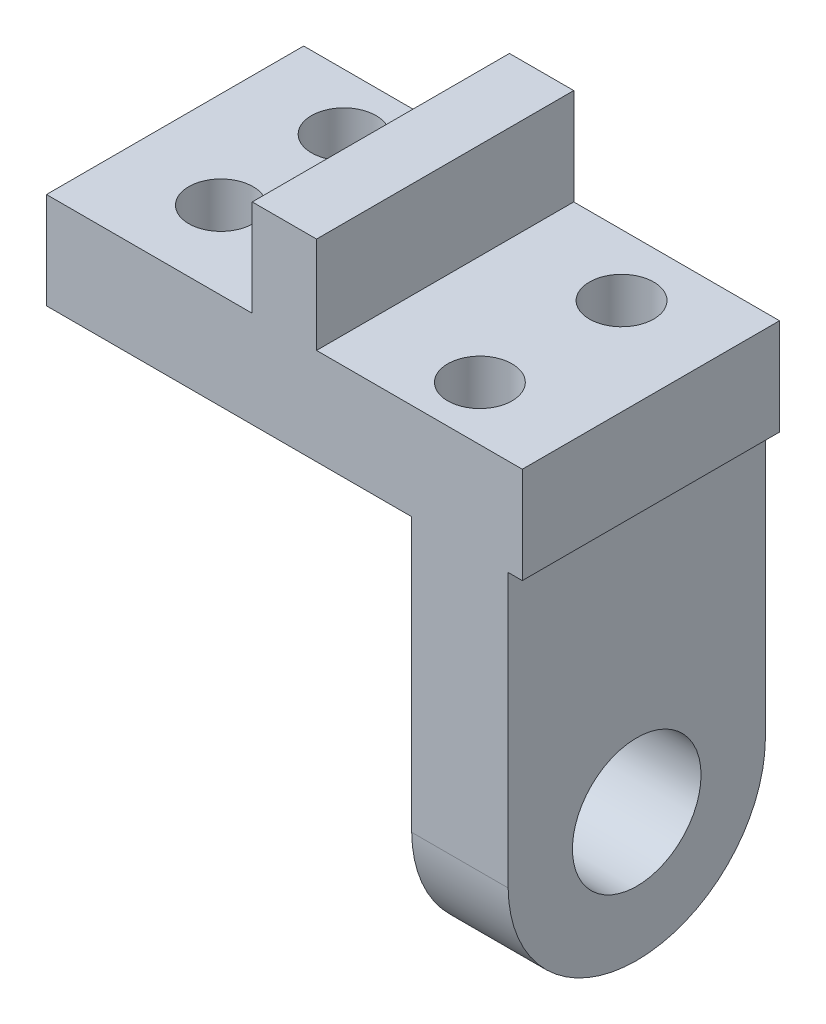
from build123d import *

# Parameters (mm, degrees)
SKETCH1_W           = 74
SKETCH1_H           = 15
BOSS_EXTRUDE1_DEPTH = 20
SKETCH2_W           = 10
SKETCH2_H           = 40
BOSS_EXTRUDE2_DEPTH = 30
SKETCH3_R           = 5.024696106
CUT_EXTRUDE4_DEPTH  = 15
SKETCH6_R           = 5
CUT_EXTRUDE5_DEPTH  = 30
SKETCH8_R           = 5
CUT_EXTRUDE6_DEPTH  = 30
SKETCH9_R           = 5
CUT_EXTRUDE7_DEPTH  = 30
SKETCH11_R          = 10
BOSS_EXTRUDE3_DEPTH = 15


with BuildPart() as part:
    # Sketch1 → Boss-Extrude1 (new, symmetric)
    with BuildSketch(Plane.XY):
        with Locations((-19.794871795, 7.5)):
            Rectangle(SKETCH1_W, SKETCH1_H)
    extrude(amount=BOSS_EXTRUDE1_DEPTH, both=True)

    # Sketch2 → Boss-Extrude2 (add)
    with BuildSketch(Plane(origin=(0, 0, 0), x_dir=(1, 0, 0), z_dir=(0, 1, 0))):
        with Locations((-19.794871795, 0)):
            Rectangle(SKETCH2_W, SKETCH2_H)
    extrude(amount=BOSS_EXTRUDE2_DEPTH)

    # Sketch3 → Cut-Extrude4 (cut)
    with BuildSketch(Plane(origin=(0, 0, 0), x_dir=(1, 0, 0), z_dir=(0, 1, 0))):
        with Locations(Location((-41.794871795, 11.238480193, 0), (0, 0, 90))):
            Circle(SKETCH3_R)
    extrude(amount=CUT_EXTRUDE4_DEPTH, mode=Mode.SUBTRACT)

    # Sketch6 → Cut-Extrude5 (cut)
    with BuildSketch(Plane(origin=(0, 15, 0), x_dir=(1, 0, 0), z_dir=(0, 1, 0))):
        with Locations(Location((-41.794871795, -7.874935053, 0), (0, 0, 270))):
            Circle(SKETCH6_R)
    extrude(amount=-CUT_EXTRUDE5_DEPTH, mode=Mode.SUBTRACT)

    # Sketch8 → Cut-Extrude6 (cut)
    with BuildSketch(Plane(origin=(0, 15, 0), x_dir=(1, 0, 0), z_dir=(0, 1, 0))):
        with Locations(Location((2.205128205, 10.435706621, 0), (0, 0, 270))):
            Circle(SKETCH8_R)
    extrude(amount=-CUT_EXTRUDE6_DEPTH, mode=Mode.SUBTRACT)

    # Sketch9 → Cut-Extrude7 (cut)
    with BuildSketch(Plane(origin=(0, 15, 0), x_dir=(1, 0, 0), z_dir=(0, 1, 0))):
        with Locations(Location((2.205128205, -11.598088542, 0), (0, 0, 270))):
            Circle(SKETCH9_R)
    extrude(amount=-CUT_EXTRUDE7_DEPTH, mode=Mode.SUBTRACT)

    # Sketch11 → Boss-Extrude3 (add)
    with BuildSketch(Plane(origin=(0, 0, 0), x_dir=(0, 0, -1), z_dir=(1, 0, 0))):
        with BuildLine():
            Line((-20, 7.5), (20, 7.5))
            Line((20, 7.5), (20, -42.5))
            ThreePointArc((20, -42.5), (0, -62.270254711), (-20, -42.5))
            Line((-20, -42.5), (-20, 7.5))
        make_face()
        with Locations((0, -42.268919804)):
            Circle(SKETCH11_R, mode=Mode.SUBTRACT)
    extrude(amount=BOSS_EXTRUDE3_DEPTH)


solid = part.part
